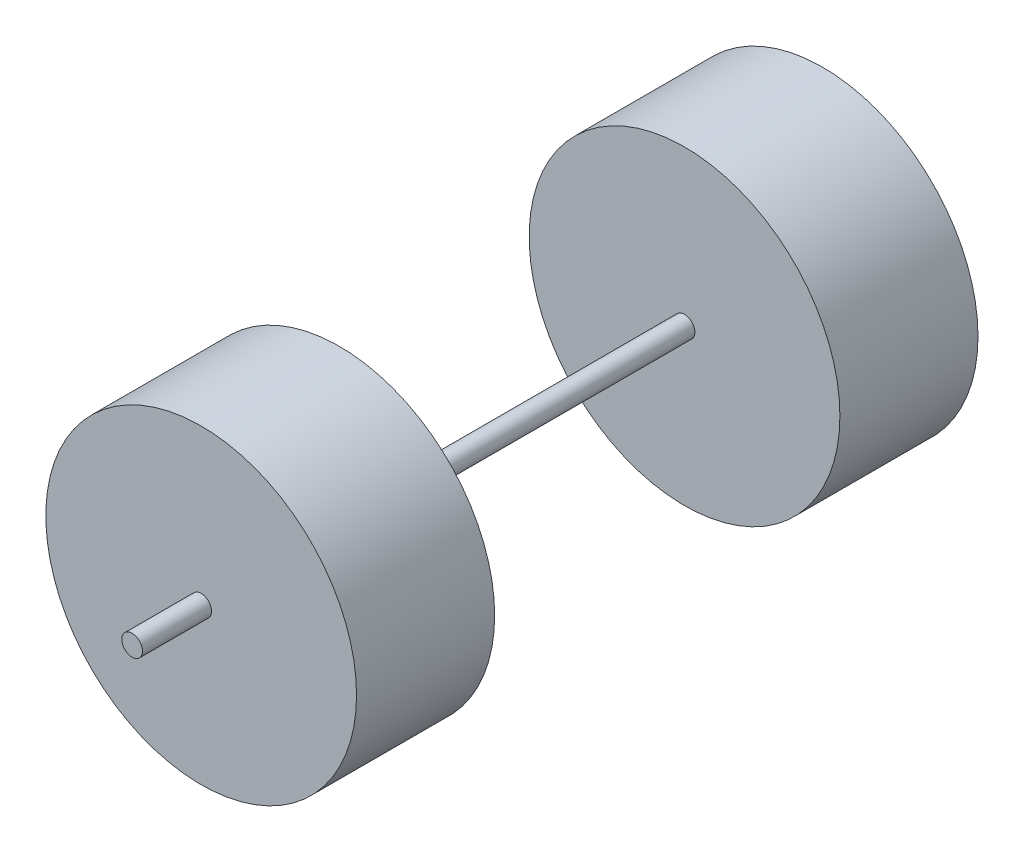
from build123d import *

# Parameters (mm, degrees)
ESBO_O1_R                = 22.5
RESSALTO_EXTRUS_O3_DEPTH = 20
ESBO_O3_R                = 1.5
RESSALTO_EXTRUS_O4_DEPTH = 50
ESBO_O4_R                = 22.5
RESSALTO_EXTRUS_O5_DEPTH = 20
ESBO_O5_R                = 1.5
RESSALTO_EXTRUS_O6_DEPTH = 10
RESSALTO_EXTRUS_O7_START = 10
ESBO_O6_R                = 1.5
RESSALTO_EXTRUS_O7_DEPTH = 10


with BuildPart() as part:
    # Esboço1 → Ressalto-extrusão3 (new body)
    with BuildSketch(Plane.XY):
        Circle(ESBO_O1_R)
    extrude(amount=RESSALTO_EXTRUS_O3_DEPTH)

    # Esboço3 → Ressalto-extrusão4 (add)
    with BuildSketch(Plane.XY.offset(20)):
        Circle(ESBO_O3_R)
    extrude(amount=RESSALTO_EXTRUS_O4_DEPTH)

    # Esboço4 → Ressalto-extrusão5 (add)
    with BuildSketch(Plane.XY.offset(70)):
        Circle(ESBO_O4_R)
    extrude(amount=RESSALTO_EXTRUS_O5_DEPTH)

    # Esboço5 → Ressalto-extrusão6 (add)
    with BuildSketch(Plane.XY.offset(90)):
        Circle(ESBO_O5_R)
    extrude(amount=RESSALTO_EXTRUS_O6_DEPTH)

    # Esboço6 → Ressalto-extrusão7 (add)
    with BuildSketch(Plane(origin=(0, 0, 0), x_dir=(-1, 0, 0), z_dir=(0, 0, -1)).offset(RESSALTO_EXTRUS_O7_START)):
        with Locations(Location((0, 0, 0), (0, 0, 180))):
            Circle(ESBO_O6_R)
    extrude(amount=-RESSALTO_EXTRUS_O7_DEPTH)


solid = part.part
